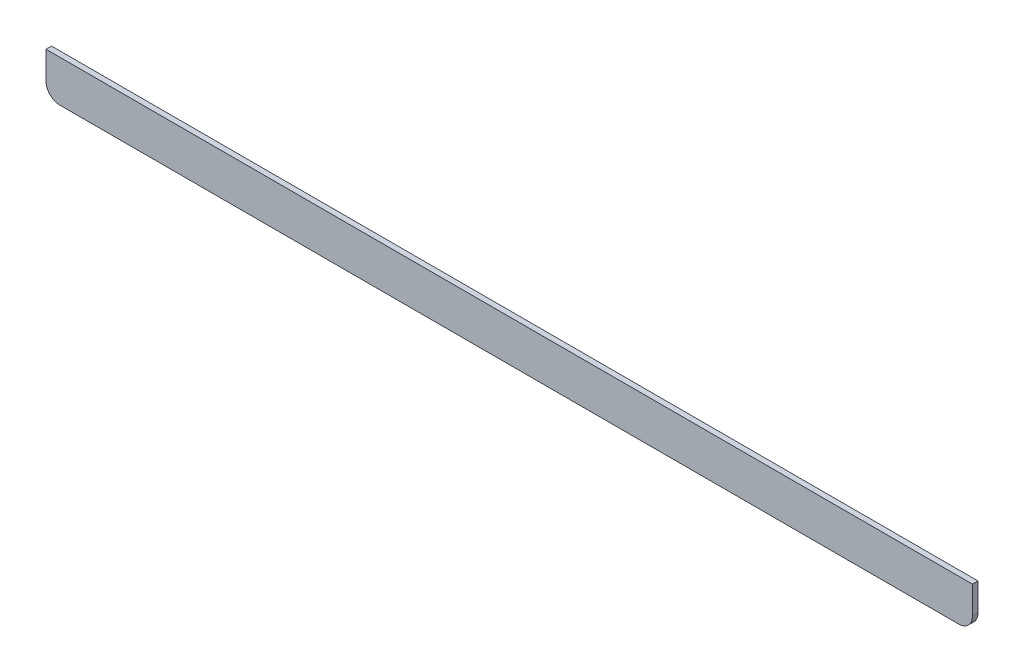
from build123d import *

# Parameters (mm, degrees)
SKETCH1_W           = 670
SKETCH1_H           = 30
BOSS_EXTRUDE1_DEPTH = 4
FILLET1_R           = 10


with BuildPart() as part:
    # Sketch1 → Boss-Extrude1 (new body)
    with BuildSketch(Plane.XY):
        Rectangle(SKETCH1_W, SKETCH1_H)
    extrude(amount=BOSS_EXTRUDE1_DEPTH)

    # Fillet1
    fillet1_edges = [part.edges().sort_by_distance(p)[0] for p in [
        (335, -15, 2),
        (-335, -15, 2),
    ]]
    fillet(fillet1_edges, radius=FILLET1_R)


solid = part.part
